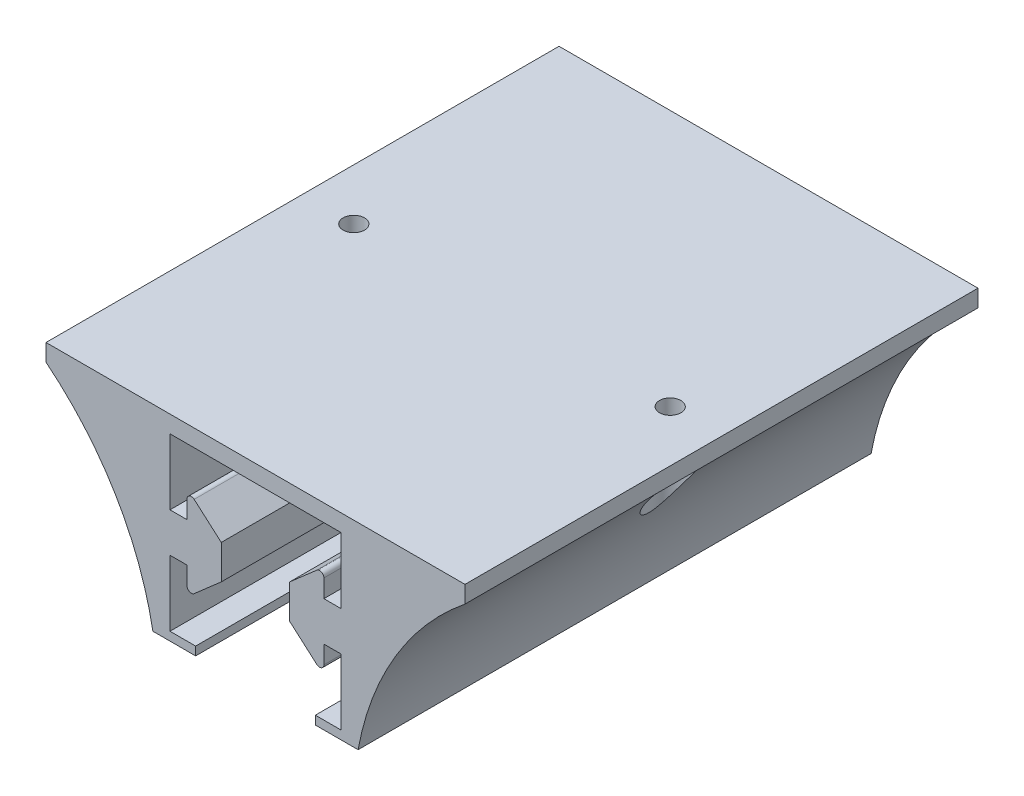
from build123d import *

# Parameters (mm, degrees)
BOSS_EXTRUDE1_DEPTH            = 38.1
BOSS_EXTRUDE3_DEPTH            = 76.2
CUT_EXTRUDE1_REACH             = 53.888
SKETCH4_R                      = 3.175
CUT_EXTRUDE1_DIRECTION_2_DEPTH = 6.35
CUT_EXTRUDE2_REACH             = 56.243
SKETCH5_R                      = 1.5875


with BuildPart() as part:
    # Sketch1 → Boss-Extrude1 (new, symmetric)
    with BuildSketch(Plane.XY):
        with BuildLine():
            Line((12.7, 12.7), (-12.7, 12.7))
            Line((-12.7, 12.7), (-12.7, 2.921))
            Line((-12.7, 2.921), (-10.16, 2.921))
            Line((-10.16, 2.921), (-10.16, 5.585607176))
            ThreePointArc((-10.16, 5.585607176), (-9.787392339, 6.163859076), (-9.106849574, 6.063493377))
            Line((-9.106849574, 6.063493377), (-5.08, 2.54))
            Line((-5.08, 2.54), (-5.08, -2.54))
            Line((-5.08, -2.54), (-9.106849574, -6.063493377))
            ThreePointArc((-9.106849574, -6.063493377), (-9.787392339, -6.163859076), (-10.16, -5.585607176))
            Line((-10.16, -5.585607176), (-10.16, -2.921))
            Line((-10.16, -2.921), (-12.7, -2.921))
            Line((-12.7, -2.921), (-12.7, -12.7))
            Line((-12.7, -12.7), (-8.89, -12.7))
            Line((-8.89, -12.7), (-8.89, -13.97))
            Line((-8.89, -13.97), (-15.24, -13.97))
            Line((-15.24, -13.97), (-15.24, 15.24))
            Line((-15.24, 15.24), (15.24, 15.24))
            Line((15.24, 15.24), (15.24, -13.97))
            Line((15.24, -13.97), (8.89, -13.97))
            Line((8.89, -13.97), (8.89, -12.7))
            Line((8.89, -12.7), (12.7, -12.7))
            Line((12.7, -12.7), (12.7, -2.921))
            Line((12.7, -2.921), (10.16, -2.921))
            Line((10.16, -2.921), (10.16, -5.585607176))
            ThreePointArc((10.16, -5.585607176), (9.787392339, -6.163859076), (9.106849574, -6.063493377))
            Line((9.106849574, -6.063493377), (5.08, -2.54))
            Line((5.08, -2.54), (5.08, 2.54))
            Line((5.08, 2.54), (9.106849574, 6.063493377))
            ThreePointArc((9.106849574, 6.063493377), (9.787392339, 6.163859076), (10.16, 5.585607176))
            Line((10.16, 5.585607176), (10.16, 2.921))
            Line((10.16, 2.921), (12.7, 2.921))
            Line((12.7, 2.921), (12.7, 12.7))
        make_face()
    extrude(amount=BOSS_EXTRUDE1_DEPTH, both=True)

    # Sketch6 → Boss-Extrude3 (add)
    with BuildSketch(Plane(origin=(0, 0, -38.1), x_dir=(-1, 0, 0), z_dir=(0, 0, -1))):
        with BuildLine():
            Line((-15.24, 15.24), (-31.115, 15.24))
            Line((-31.115, 15.24), (-31.115, 12.7))
            ThreePointArc((-31.115, 12.7), (-20.774098647, 0.795596044), (-15.24, -13.97))
            Line((-15.24, -13.97), (-15.24, 15.24))
        make_face()
        with BuildLine():
            Line((15.24, 15.24), (31.115, 15.24))
            Line((31.115, 15.24), (31.115, 12.7))
            ThreePointArc((31.115, 12.7), (20.774098647, 0.795596044), (15.24, -13.97))
            Line((15.24, -13.97), (15.24, 15.24))
        make_face()
    extrude(amount=-BOSS_EXTRUDE3_DEPTH)

    # Sketch4 → Cut-Extrude1 (cut, up to next)
    with BuildSketch(Plane(origin=(0, 2.54, 0), x_dir=(1, 0, 0), z_dir=(0, 1, 0)), mode=Mode.PRIVATE) as cut_extrude1_sk1:
        with Locations(Location((23.495, 0, 0), (0, 0, 90))):
            Circle(SKETCH4_R)
    cut_extrude1_tool1 = extrude(cut_extrude1_sk1.sketch, amount=-CUT_EXTRUDE1_REACH, mode=Mode.PRIVATE) & part.part
    cut_extrude1 = cut_extrude1_tool1.solids().sort_by_distance((23.495, 2.54, 0))[0]
    add(cut_extrude1, mode=Mode.SUBTRACT)

    # Sketch4 → Cut-Extrude1 direction 2 (cut)
    with BuildSketch(Plane(origin=(0, 2.54, 0), x_dir=(1, 0, 0), z_dir=(0, 1, 0))):
        with Locations(Location((23.495, 0, 0), (0, 0, 90))):
            Circle(SKETCH4_R)
    cut_extrude1_direction_2 = extrude(amount=CUT_EXTRUDE1_DIRECTION_2_DEPTH, mode=Mode.SUBTRACT)

    # Sketch5 → Cut-Extrude2 (cut, up to next)
    with BuildSketch(Plane.XZ.offset(-8.89), mode=Mode.PRIVATE) as cut_extrude2_sk1:
        with Locations(Location((23.495, 0, 0), (0, 0, 270))):
            Circle(SKETCH5_R)
    cut_extrude2_tool1 = extrude(cut_extrude2_sk1.sketch, amount=-CUT_EXTRUDE2_REACH, mode=Mode.PRIVATE) & part.part
    cut_extrude2 = cut_extrude2_tool1.solids().sort_by_distance((23.495, 8.89, 0))[0]
    add(cut_extrude2, mode=Mode.SUBTRACT)

    # Mirror1: Cut-Extrude1, Cut-Extrude1 direction 2, Cut-Extrude2 across plane
    add(cut_extrude1.mirror(Plane(origin=(0, 0, 0), x_dir=(0, 0, 1), z_dir=(1, 0, 0))), mode=Mode.SUBTRACT)
    add(cut_extrude1_direction_2.mirror(Plane(origin=(0, 0, 0), x_dir=(0, 0, 1), z_dir=(1, 0, 0))), mode=Mode.SUBTRACT)
    add(cut_extrude2.mirror(Plane(origin=(0, 0, 0), x_dir=(0, 0, 1), z_dir=(1, 0, 0))), mode=Mode.SUBTRACT)


solid = part.part
